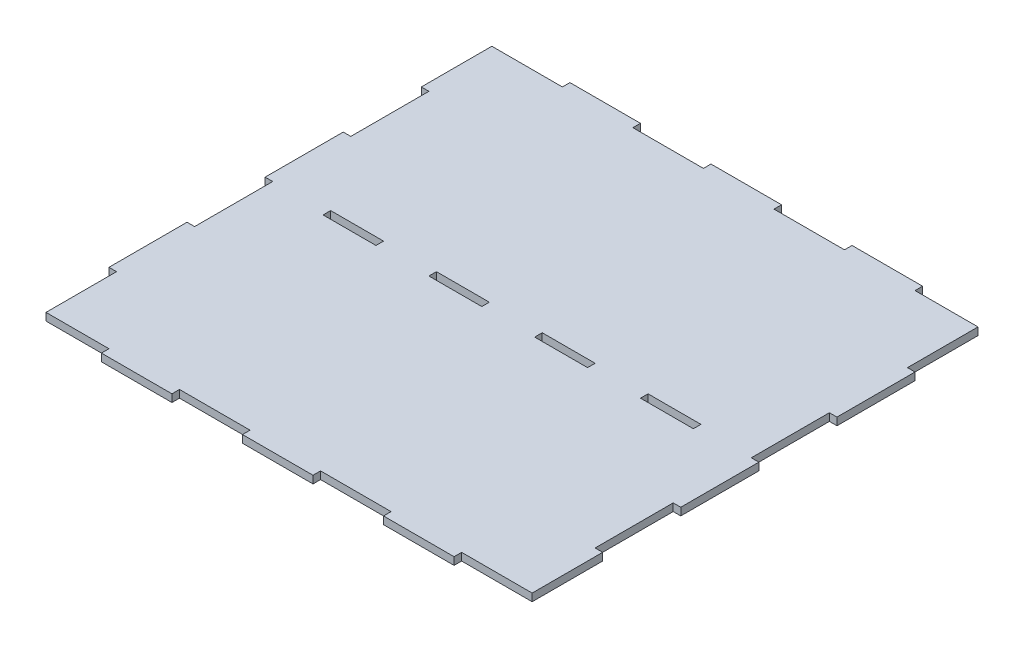
from build123d import *

# Parameters (mm, degrees)
SKETCH1_W           = 21
SKETCH1_H           = 3
BOSS_EXTRUDE1_DEPTH = 3


with BuildPart() as part:
    # Sketch1 → Boss-Extrude1 (new body)
    with BuildSketch(Plane(origin=(0, 0, 0), x_dir=(1, 0, 0), z_dir=(0, 1, 0))):
        Polygon((-95, -62), (-95, -90), (-70, -90), (-70, -93), (-42, -93), (-42, -90), (-14, -90), (-14, -93), (14, -93), (14, -90), (42, -90), (42, -93), (70, -93), (70, -90), (98, -90), (98, -62), (95, -62), (95, -31), (98, -31), (98, 0), (95, 0), (95, 31), (98, 31), (98, 62), (95, 62), (95, 90), (70, 90), (70, 93), (42, 93), (42, 90), (14, 90), (14, 93), (-14, 93), (-14, 90), (-42, 90), (-42, 93), (-70, 93), (-70, 90), (-98, 90), (-98, 62), (-95, 62), (-95, 31), (-98, 31), (-98, 0), (-95, 0), (-95, -31), (-98, -31), (-98, -62), align=None)
        with Locations((-63, 0)):
            Rectangle(SKETCH1_W, SKETCH1_H, mode=Mode.SUBTRACT)
        with Locations((-21, 0)):
            Rectangle(SKETCH1_W, SKETCH1_H, mode=Mode.SUBTRACT)
        with Locations((21, 0)):
            Rectangle(SKETCH1_W, SKETCH1_H, mode=Mode.SUBTRACT)
        with Locations((63, 0)):
            Rectangle(SKETCH1_W, SKETCH1_H, mode=Mode.SUBTRACT)
    extrude(amount=BOSS_EXTRUDE1_DEPTH)


solid = part.part
